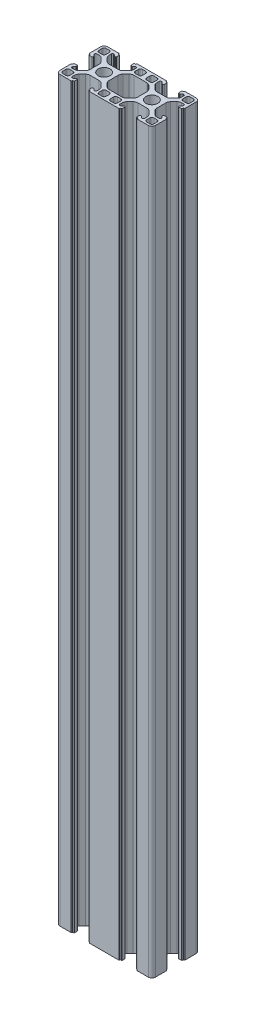
from build123d import *

# Parameters (mm, degrees)
EXTRUDE_1_DEPTH = 309


with BuildPart() as part:
    # Эскиз1 → Бобышка-Вытянуть1 (new body)
    with BuildSketch(Plane(origin=(0, 0, 0), x_dir=(1, 0, 0), z_dir=(0, 1, 0))):
        with BuildLine():
            Line((9.247825015, 4.683728486), (11.146605684, 4.683728486))
            ThreePointArc((11.146605684, 4.683728486), (11.911972549, 4.835969421), (12.560819246, 5.269514923))
            Line((12.560819246, 5.269514923), (13.862038577, 6.570734254))
            ThreePointArc((13.862038577, 6.570734254), (14.29558408, 7.219580952), (14.447825015, 7.984947817))
            Line((14.447825015, 7.984947817), (14.447825015, 8.883728486))
            ThreePointArc((14.447825015, 8.883728486), (14.301378405, 9.237281876), (13.947825015, 9.383728486))
            Line((13.947825015, 9.383728486), (13.844931796, 9.383728486))
            ThreePointArc((13.844931796, 9.383728486), (13.65359008, 9.345668252), (13.491378405, 9.237281876))
            Line((13.491378405, 9.237281876), (13.01104832, 8.75695179))
            ThreePointArc((13.01104832, 8.75695179), (12.929942482, 8.702758603), (12.834271624, 8.683728486))
            Line((12.834271624, 8.683728486), (12.547825015, 8.683728486))
            ThreePointArc((12.547825015, 8.683728486), (12.37104832, 8.75695179), (12.297825015, 8.933728486))
            Line((12.297825015, 8.933728486), (12.297825015, 10.082799306))
            ThreePointArc((12.297825015, 10.082799306), (12.341758998, 10.188865323), (12.447825015, 10.232799306))
            Line((12.447825015, 10.232799306), (12.947825015, 10.232799306))
            Line((12.947825015, 10.232799306), (12.947825015, 10.533728486))
            ThreePointArc((12.947825015, 10.533728486), (12.991758998, 10.639794503), (13.097825015, 10.683728486))
            Line((13.097825015, 10.683728486), (17.747825015, 10.683728486))
            ThreePointArc((17.747825015, 10.683728486), (18.808485187, 10.244388658), (19.247825015, 9.183728486))
            Line((19.247825015, 9.183728486), (19.247825015, 4.533728486))
            ThreePointArc((19.247825015, 4.533728486), (19.203891032, 4.427662469), (19.097825015, 4.383728486))
            Line((19.097825015, 4.383728486), (18.796895835, 4.383728486))
            Line((18.796895835, 4.383728486), (18.796895835, 3.883728486))
            ThreePointArc((18.796895835, 3.883728486), (18.752961853, 3.777662469), (18.646895835, 3.733728486))
            Line((18.646895835, 3.733728486), (17.497825015, 3.733728486))
            ThreePointArc((17.497825015, 3.733728486), (17.32104832, 3.80695179), (17.247825015, 3.983728486))
            Line((17.247825015, 3.983728486), (17.247825015, 4.270175095))
            ThreePointArc((17.247825015, 4.270175095), (17.266855132, 4.365845953), (17.32104832, 4.44695179))
            Line((17.32104832, 4.44695179), (17.801378405, 4.927281876))
            ThreePointArc((17.801378405, 4.927281876), (17.909764781, 5.089493551), (17.947825015, 5.280835267))
            Line((17.947825015, 5.280835267), (17.947825015, 5.383728486))
            ThreePointArc((17.947825015, 5.383728486), (17.801378405, 5.737281876), (17.447825015, 5.883728486))
            Line((17.447825015, 5.883728486), (16.549044346, 5.883728486))
            ThreePointArc((16.549044346, 5.883728486), (15.783677481, 5.731487551), (15.134830783, 5.297942048))
            Line((15.134830783, 5.297942048), (13.833611452, 3.996722717))
            ThreePointArc((13.833611452, 3.996722717), (13.40006595, 3.34787602), (13.247825015, 2.582509155))
            Line((13.247825015, 2.582509155), (13.247825015, 0.683728486))
            Line((13.247825015, 0.683728486), (13.247825015, -1.215052183))
            ThreePointArc((13.247825015, -1.215052183), (13.40006595, -1.980419048), (13.833611452, -2.629265746))
            Line((13.833611452, -2.629265746), (15.134830783, -3.930485077))
            ThreePointArc((15.134830783, -3.930485077), (15.783677481, -4.364030579), (16.549044346, -4.516271514))
            Line((16.549044346, -4.516271514), (17.447825015, -4.516271514))
            ThreePointArc((17.447825015, -4.516271514), (17.801378405, -4.369824905), (17.947825015, -4.016271514))
            Line((17.947825015, -4.016271514), (17.947825015, -3.913378295))
            ThreePointArc((17.947825015, -3.913378295), (17.909764781, -3.722036579), (17.801378405, -3.559824905))
            Line((17.801378405, -3.559824905), (17.32104832, -3.079494819))
            ThreePointArc((17.32104832, -3.079494819), (17.266855132, -2.998388982), (17.247825015, -2.902718124))
            Line((17.247825015, -2.902718124), (17.247825015, -2.616271514))
            ThreePointArc((17.247825015, -2.616271514), (17.32104832, -2.439494819), (17.497825015, -2.366271514))
            Line((17.497825015, -2.366271514), (18.646895835, -2.366271514))
            ThreePointArc((18.646895835, -2.366271514), (18.752961853, -2.410205497), (18.796895835, -2.516271514))
            Line((18.796895835, -2.516271514), (18.796895835, -3.016271514))
            Line((18.796895835, -3.016271514), (19.097825015, -3.016271514))
            ThreePointArc((19.097825015, -3.016271514), (19.203891032, -3.060205497), (19.247825015, -3.166271514))
            Line((19.247825015, -3.166271514), (19.247825015, -7.816271514))
            ThreePointArc((19.247825015, -7.816271514), (18.808485187, -8.876931686), (17.747825015, -9.316271514))
            Line((17.747825015, -9.316271514), (13.097825015, -9.316271514))
            ThreePointArc((13.097825015, -9.316271514), (12.991758998, -9.272337531), (12.947825015, -9.166271514))
            Line((12.947825015, -9.166271514), (12.947825015, -8.865342335))
            Line((12.947825015, -8.865342335), (12.447825015, -8.865342335))
            ThreePointArc((12.447825015, -8.865342335), (12.341758998, -8.821408352), (12.297825015, -8.715342335))
            Line((12.297825015, -8.715342335), (12.297825015, -7.566271514))
            ThreePointArc((12.297825015, -7.566271514), (12.37104832, -7.389494819), (12.547825015, -7.316271514))
            Line((12.547825015, -7.316271514), (12.834271624, -7.316271514))
            ThreePointArc((12.834271624, -7.316271514), (12.929942482, -7.335301631), (13.01104832, -7.389494819))
            Line((13.01104832, -7.389494819), (13.491378405, -7.869824905))
            ThreePointArc((13.491378405, -7.869824905), (13.65359008, -7.978211281), (13.844931796, -8.016271514))
            Line((13.844931796, -8.016271514), (13.947825015, -8.016271514))
            ThreePointArc((13.947825015, -8.016271514), (14.301378405, -7.869824905), (14.447825015, -7.516271514))
            Line((14.447825015, -7.516271514), (14.447825015, -6.617490845))
            ThreePointArc((14.447825015, -6.617490845), (14.29558408, -5.85212398), (13.862038577, -5.203277283))
            Line((13.862038577, -5.203277283), (12.560819246, -3.902057952))
            ThreePointArc((12.560819246, -3.902057952), (11.911972549, -3.468512449), (11.146605684, -3.316271514))
            Line((11.146605684, -3.316271514), (9.247825015, -3.316271514))
            Line((9.247825015, -3.316271514), (7.349044346, -3.316271514))
            ThreePointArc((7.349044346, -3.316271514), (6.583677481, -3.468512449), (5.934830783, -3.902057952))
            Line((5.934830783, -3.902057952), (4.633611452, -5.203277283))
            ThreePointArc((4.633611452, -5.203277283), (4.20006595, -5.85212398), (4.047825015, -6.617490845))
            Line((4.047825015, -6.617490845), (4.047825015, -7.516271514))
            ThreePointArc((4.047825015, -7.516271514), (4.194271624, -7.869824905), (4.547825015, -8.016271514))
            Line((4.547825015, -8.016271514), (4.650718234, -8.016271514))
            ThreePointArc((4.650718234, -8.016271514), (4.84205995, -7.978211281), (5.004271624, -7.869824905))
            Line((5.004271624, -7.869824905), (5.48460171, -7.389494819))
            ThreePointArc((5.48460171, -7.389494819), (5.565707547, -7.335301631), (5.661378405, -7.316271514))
            Line((5.661378405, -7.316271514), (5.947825015, -7.316271514))
            ThreePointArc((5.947825015, -7.316271514), (6.12460171, -7.389494819), (6.197825015, -7.566271514))
            Line((6.197825015, -7.566271514), (6.197825015, -8.715342335))
            ThreePointArc((6.197825015, -8.715342335), (6.153891032, -8.821408352), (6.047825015, -8.865342335))
            Line((6.047825015, -8.865342335), (5.547825015, -8.865342335))
            Line((5.547825015, -8.865342335), (5.547825015, -9.166271514))
            ThreePointArc((5.547825015, -9.166271514), (5.503891032, -9.272337531), (5.397825015, -9.316271514))
            Line((5.397825015, -9.316271514), (0.747825015, -9.316271514))
            Line((0.747825015, -9.316271514), (-2.252174985, -9.316271514))
            Line((-2.252174985, -9.316271514), (-6.902174985, -9.316271514))
            ThreePointArc((-6.902174985, -9.316271514), (-7.008241002, -9.272337531), (-7.052174985, -9.166271514))
            Line((-7.052174985, -9.166271514), (-7.052174985, -8.865342335))
            Line((-7.052174985, -8.865342335), (-7.552174985, -8.865342335))
            ThreePointArc((-7.552174985, -8.865342335), (-7.658241002, -8.821408352), (-7.702174985, -8.715342335))
            Line((-7.702174985, -8.715342335), (-7.702174985, -7.566271514))
            ThreePointArc((-7.702174985, -7.566271514), (-7.62895168, -7.389494819), (-7.452174985, -7.316271514))
            Line((-7.452174985, -7.316271514), (-7.165728376, -7.316271514))
            ThreePointArc((-7.165728376, -7.316271514), (-7.070057518, -7.335301631), (-6.98895168, -7.389494819))
            Line((-6.98895168, -7.389494819), (-6.508621595, -7.869824905))
            ThreePointArc((-6.508621595, -7.869824905), (-6.34640992, -7.978211281), (-6.155068204, -8.016271514))
            Line((-6.155068204, -8.016271514), (-6.052174985, -8.016271514))
            ThreePointArc((-6.052174985, -8.016271514), (-5.698621595, -7.869824905), (-5.552174985, -7.516271514))
            Line((-5.552174985, -7.516271514), (-5.552174985, -6.617490845))
            ThreePointArc((-5.552174985, -6.617490845), (-5.70441592, -5.85212398), (-6.137961423, -5.203277283))
            Line((-6.137961423, -5.203277283), (-7.439180754, -3.902057952))
            ThreePointArc((-7.439180754, -3.902057952), (-8.088027451, -3.468512449), (-8.853394316, -3.316271514))
            Line((-8.853394316, -3.316271514), (-10.752174985, -3.316271514))
            Line((-10.752174985, -3.316271514), (-12.650955654, -3.316271514))
            ThreePointArc((-12.650955654, -3.316271514), (-13.416322519, -3.468512449), (-14.065169217, -3.902057952))
            Line((-14.065169217, -3.902057952), (-15.366388548, -5.203277283))
            ThreePointArc((-15.366388548, -5.203277283), (-15.79993405, -5.85212398), (-15.952174985, -6.617490845))
            Line((-15.952174985, -6.617490845), (-15.952174985, -7.516271514))
            ThreePointArc((-15.952174985, -7.516271514), (-15.805728376, -7.869824905), (-15.452174985, -8.016271514))
            Line((-15.452174985, -8.016271514), (-15.349281766, -8.016271514))
            ThreePointArc((-15.349281766, -8.016271514), (-15.15794005, -7.978211281), (-14.995728376, -7.869824905))
            Line((-14.995728376, -7.869824905), (-14.51539829, -7.389494819))
            ThreePointArc((-14.51539829, -7.389494819), (-14.434292453, -7.335301631), (-14.338621595, -7.316271514))
            Line((-14.338621595, -7.316271514), (-14.052174985, -7.316271514))
            ThreePointArc((-14.052174985, -7.316271514), (-13.87539829, -7.389494819), (-13.802174985, -7.566271514))
            Line((-13.802174985, -7.566271514), (-13.802174985, -8.715342335))
            ThreePointArc((-13.802174985, -8.715342335), (-13.846108968, -8.821408352), (-13.952174985, -8.865342335))
            Line((-13.952174985, -8.865342335), (-14.452174985, -8.865342335))
            Line((-14.452174985, -8.865342335), (-14.452174985, -9.166271514))
            ThreePointArc((-14.452174985, -9.166271514), (-14.496108968, -9.272337531), (-14.602174985, -9.316271514))
            Line((-14.602174985, -9.316271514), (-19.252174985, -9.316271514))
            ThreePointArc((-19.252174985, -9.316271514), (-20.312835157, -8.876931686), (-20.752174985, -7.816271514))
            Line((-20.752174985, -7.816271514), (-20.752174985, -3.166271514))
            ThreePointArc((-20.752174985, -3.166271514), (-20.708241002, -3.060205497), (-20.602174985, -3.016271514))
            Line((-20.602174985, -3.016271514), (-20.301245806, -3.016271514))
            Line((-20.301245806, -3.016271514), (-20.301245806, -2.516271514))
            ThreePointArc((-20.301245806, -2.516271514), (-20.257311823, -2.410205497), (-20.151245806, -2.366271514))
            Line((-20.151245806, -2.366271514), (-19.002174985, -2.366271514))
            ThreePointArc((-19.002174985, -2.366271514), (-18.82539829, -2.439494819), (-18.752174985, -2.616271514))
            Line((-18.752174985, -2.616271514), (-18.752174985, -2.902718124))
            ThreePointArc((-18.752174985, -2.902718124), (-18.771205102, -2.998388982), (-18.82539829, -3.079494819))
            Line((-18.82539829, -3.079494819), (-19.305728376, -3.559824905))
            ThreePointArc((-19.305728376, -3.559824905), (-19.414114751, -3.722036579), (-19.452174985, -3.913378295))
            Line((-19.452174985, -3.913378295), (-19.452174985, -4.016271514))
            ThreePointArc((-19.452174985, -4.016271514), (-19.305728376, -4.369824905), (-18.952174985, -4.516271514))
            Line((-18.952174985, -4.516271514), (-18.053394316, -4.516271514))
            ThreePointArc((-18.053394316, -4.516271514), (-17.288027451, -4.364030579), (-16.639180754, -3.930485077))
            Line((-16.639180754, -3.930485077), (-15.337961423, -2.629265746))
            ThreePointArc((-15.337961423, -2.629265746), (-14.90441592, -1.980419048), (-14.752174985, -1.215052183))
            Line((-14.752174985, -1.215052183), (-14.752174985, 0.683728486))
            Line((-14.752174985, 0.683728486), (-14.752174985, 2.582509155))
            ThreePointArc((-14.752174985, 2.582509155), (-14.90441592, 3.34787602), (-15.337961423, 3.996722717))
            Line((-15.337961423, 3.996722717), (-16.639180754, 5.297942048))
            ThreePointArc((-16.639180754, 5.297942048), (-17.288027451, 5.731487551), (-18.053394316, 5.883728486))
            Line((-18.053394316, 5.883728486), (-18.952174985, 5.883728486))
            ThreePointArc((-18.952174985, 5.883728486), (-19.305728376, 5.737281876), (-19.452174985, 5.383728486))
            Line((-19.452174985, 5.383728486), (-19.452174985, 5.280835267))
            ThreePointArc((-19.452174985, 5.280835267), (-19.414114751, 5.089493551), (-19.305728376, 4.927281876))
            Line((-19.305728376, 4.927281876), (-18.82539829, 4.44695179))
            ThreePointArc((-18.82539829, 4.44695179), (-18.771205102, 4.365845953), (-18.752174985, 4.270175095))
            Line((-18.752174985, 4.270175095), (-18.752174985, 3.983728486))
            ThreePointArc((-18.752174985, 3.983728486), (-18.82539829, 3.80695179), (-19.002174985, 3.733728486))
            Line((-19.002174985, 3.733728486), (-20.151245806, 3.733728486))
            ThreePointArc((-20.151245806, 3.733728486), (-20.257311823, 3.777662469), (-20.301245806, 3.883728486))
            Line((-20.301245806, 3.883728486), (-20.301245806, 4.383728486))
            Line((-20.301245806, 4.383728486), (-20.602174985, 4.383728486))
            ThreePointArc((-20.602174985, 4.383728486), (-20.708241002, 4.427662469), (-20.752174985, 4.533728486))
            Line((-20.752174985, 4.533728486), (-20.752174985, 9.183728486))
            ThreePointArc((-20.752174985, 9.183728486), (-20.312835157, 10.244388658), (-19.252174985, 10.683728486))
            Line((-19.252174985, 10.683728486), (-14.602174985, 10.683728486))
            ThreePointArc((-14.602174985, 10.683728486), (-14.496108968, 10.639794503), (-14.452174985, 10.533728486))
            Line((-14.452174985, 10.533728486), (-14.452174985, 10.232799306))
            Line((-14.452174985, 10.232799306), (-13.952174985, 10.232799306))
            ThreePointArc((-13.952174985, 10.232799306), (-13.846108968, 10.188865323), (-13.802174985, 10.082799306))
            Line((-13.802174985, 10.082799306), (-13.802174985, 8.933728486))
            ThreePointArc((-13.802174985, 8.933728486), (-13.87539829, 8.75695179), (-14.052174985, 8.683728486))
            Line((-14.052174985, 8.683728486), (-14.338621595, 8.683728486))
            ThreePointArc((-14.338621595, 8.683728486), (-14.434292453, 8.702758603), (-14.51539829, 8.75695179))
            Line((-14.51539829, 8.75695179), (-14.995728376, 9.237281876))
            ThreePointArc((-14.995728376, 9.237281876), (-15.15794005, 9.345668252), (-15.349281766, 9.383728486))
            Line((-15.349281766, 9.383728486), (-15.452174985, 9.383728486))
            ThreePointArc((-15.452174985, 9.383728486), (-15.805728376, 9.237281876), (-15.952174985, 8.883728486))
            Line((-15.952174985, 8.883728486), (-15.952174985, 7.984947817))
            ThreePointArc((-15.952174985, 7.984947817), (-15.79993405, 7.219580952), (-15.366388548, 6.570734254))
            Line((-15.366388548, 6.570734254), (-14.065169217, 5.269514923))
            ThreePointArc((-14.065169217, 5.269514923), (-13.416322519, 4.835969421), (-12.650955654, 4.683728486))
            Line((-12.650955654, 4.683728486), (-10.752174985, 4.683728486))
            Line((-10.752174985, 4.683728486), (-8.853394316, 4.683728486))
            ThreePointArc((-8.853394316, 4.683728486), (-8.088027451, 4.835969421), (-7.439180754, 5.269514923))
            Line((-7.439180754, 5.269514923), (-6.137961423, 6.570734254))
            ThreePointArc((-6.137961423, 6.570734254), (-5.70441592, 7.219580952), (-5.552174985, 7.984947817))
            Line((-5.552174985, 7.984947817), (-5.552174985, 8.883728486))
            ThreePointArc((-5.552174985, 8.883728486), (-5.698621595, 9.237281876), (-6.052174985, 9.383728486))
            Line((-6.052174985, 9.383728486), (-6.155068204, 9.383728486))
            ThreePointArc((-6.155068204, 9.383728486), (-6.34640992, 9.345668252), (-6.508621595, 9.237281876))
            Line((-6.508621595, 9.237281876), (-6.98895168, 8.75695179))
            ThreePointArc((-6.98895168, 8.75695179), (-7.070057518, 8.702758603), (-7.165728376, 8.683728486))
            Line((-7.165728376, 8.683728486), (-7.452174985, 8.683728486))
            ThreePointArc((-7.452174985, 8.683728486), (-7.62895168, 8.75695179), (-7.702174985, 8.933728486))
            Line((-7.702174985, 8.933728486), (-7.702174985, 10.082799306))
            ThreePointArc((-7.702174985, 10.082799306), (-7.658241002, 10.188865323), (-7.552174985, 10.232799306))
            Line((-7.552174985, 10.232799306), (-7.052174985, 10.232799306))
            Line((-7.052174985, 10.232799306), (-7.052174985, 10.533728486))
            ThreePointArc((-7.052174985, 10.533728486), (-7.008241002, 10.639794503), (-6.902174985, 10.683728486))
            Line((-6.902174985, 10.683728486), (-2.252174985, 10.683728486))
            Line((-2.252174985, 10.683728486), (0.747825015, 10.683728486))
            Line((0.747825015, 10.683728486), (5.397825015, 10.683728486))
            ThreePointArc((5.397825015, 10.683728486), (5.503891032, 10.639794503), (5.547825015, 10.533728486))
            Line((5.547825015, 10.533728486), (5.547825015, 10.232799306))
            Line((5.547825015, 10.232799306), (6.047825015, 10.232799306))
            ThreePointArc((6.047825015, 10.232799306), (6.153891032, 10.188865323), (6.197825015, 10.082799306))
            Line((6.197825015, 10.082799306), (6.197825015, 8.933728486))
            ThreePointArc((6.197825015, 8.933728486), (6.12460171, 8.75695179), (5.947825015, 8.683728486))
            Line((5.947825015, 8.683728486), (5.661378405, 8.683728486))
            ThreePointArc((5.661378405, 8.683728486), (5.565707547, 8.702758603), (5.48460171, 8.75695179))
            Line((5.48460171, 8.75695179), (5.004271624, 9.237281876))
            ThreePointArc((5.004271624, 9.237281876), (4.84205995, 9.345668252), (4.650718234, 9.383728486))
            Line((4.650718234, 9.383728486), (4.547825015, 9.383728486))
            ThreePointArc((4.547825015, 9.383728486), (4.194271624, 9.237281876), (4.047825015, 8.883728486))
            Line((4.047825015, 8.883728486), (4.047825015, 7.984947817))
            ThreePointArc((4.047825015, 7.984947817), (4.20006595, 7.219580952), (4.633611452, 6.570734254))
            Line((4.633611452, 6.570734254), (5.934830783, 5.269514923))
            ThreePointArc((5.934830783, 5.269514923), (6.583677481, 4.835969421), (7.349044346, 4.683728486))
            Line((7.349044346, 4.683728486), (9.247825015, 4.683728486))
        make_face()
        with BuildLine():
            Line((16.147825015, 6.783728486), (17.547825015, 6.783728486))
            ThreePointArc((17.547825015, 6.783728486), (18.11351044, 7.018043061), (18.347825015, 7.583728486))
            Line((18.347825015, 7.583728486), (18.347825015, 8.983728486))
            ThreePointArc((18.347825015, 8.983728486), (18.11351044, 9.549413911), (17.547825015, 9.783728486))
            Line((17.547825015, 9.783728486), (16.147825015, 9.783728486))
            ThreePointArc((16.147825015, 9.783728486), (15.58213959, 9.549413911), (15.347825015, 8.983728486))
            Line((15.347825015, 8.983728486), (15.347825015, 7.583728486))
            ThreePointArc((15.347825015, 7.583728486), (15.58213959, 7.018043061), (16.147825015, 6.783728486))
        make_face(mode=Mode.SUBTRACT)
        with BuildLine():
            Line((15.347825015, -6.216271514), (15.347825015, -7.616271514))
            ThreePointArc((15.347825015, -7.616271514), (15.58213959, -8.181956939), (16.147825015, -8.416271514))
            Line((16.147825015, -8.416271514), (17.547825015, -8.416271514))
            ThreePointArc((17.547825015, -8.416271514), (18.11351044, -8.181956939), (18.347825015, -7.616271514))
            Line((18.347825015, -7.616271514), (18.347825015, -6.216271514))
            ThreePointArc((18.347825015, -6.216271514), (18.11351044, -5.650586089), (17.547825015, -5.416271514))
            Line((17.547825015, -5.416271514), (16.147825015, -5.416271514))
            ThreePointArc((16.147825015, -5.416271514), (15.58213959, -5.650586089), (15.347825015, -6.216271514))
        make_face(mode=Mode.SUBTRACT)
        with BuildLine():
            Line((2.347825015, -5.416271514), (0.947825015, -5.416271514))
            ThreePointArc((0.947825015, -5.416271514), (0.38213959, -5.650586089), (0.147825015, -6.216271514))
            Line((0.147825015, -6.216271514), (0.147825015, -7.616271514))
            ThreePointArc((0.147825015, -7.616271514), (0.38213959, -8.181956939), (0.947825015, -8.416271514))
            Line((0.947825015, -8.416271514), (2.347825015, -8.416271514))
            ThreePointArc((2.347825015, -8.416271514), (2.91351044, -8.181956939), (3.147825015, -7.616271514))
            Line((3.147825015, -7.616271514), (3.147825015, -6.216271514))
            ThreePointArc((3.147825015, -6.216271514), (2.91351044, -5.650586089), (2.347825015, -5.416271514))
        make_face(mode=Mode.SUBTRACT)
        with BuildLine():
            Line((1.047825015, -4.516271514), (1.946605684, -4.516271514))
            ThreePointArc((1.946605684, -4.516271514), (2.711972549, -4.364030579), (3.360819246, -3.930485077))
            Line((3.360819246, -3.930485077), (4.662038577, -2.629265746))
            ThreePointArc((4.662038577, -2.629265746), (5.09558408, -1.980419048), (5.247825015, -1.215052183))
            Line((5.247825015, -1.215052183), (5.247825015, 0.683728486))
            Line((5.247825015, 0.683728486), (5.247825015, 2.582509155))
            ThreePointArc((5.247825015, 2.582509155), (5.09558408, 3.34787602), (4.662038577, 3.996722717))
            Line((4.662038577, 3.996722717), (3.360819246, 5.297942048))
            ThreePointArc((3.360819246, 5.297942048), (2.711972549, 5.731487551), (1.946605684, 5.883728486))
            Line((1.946605684, 5.883728486), (1.047825015, 5.883728486))
            Line((1.047825015, 5.883728486), (-2.552174985, 5.883728486))
            Line((-2.552174985, 5.883728486), (-3.450955654, 5.883728486))
            ThreePointArc((-3.450955654, 5.883728486), (-4.216322519, 5.731487551), (-4.865169217, 5.297942048))
            Line((-4.865169217, 5.297942048), (-6.166388548, 3.996722717))
            ThreePointArc((-6.166388548, 3.996722717), (-6.59993405, 3.34787602), (-6.752174985, 2.582509155))
            Line((-6.752174985, 2.582509155), (-6.752174985, 0.683728486))
            Line((-6.752174985, 0.683728486), (-6.752174985, -1.215052183))
            ThreePointArc((-6.752174985, -1.215052183), (-6.59993405, -1.980419048), (-6.166388548, -2.629265746))
            Line((-6.166388548, -2.629265746), (-4.865169217, -3.930485077))
            ThreePointArc((-4.865169217, -3.930485077), (-4.216322519, -4.364030579), (-3.450955654, -4.516271514))
            Line((-3.450955654, -4.516271514), (-2.552174985, -4.516271514))
            Line((-2.552174985, -4.516271514), (1.047825015, -4.516271514))
        make_face(mode=Mode.SUBTRACT)
        with BuildLine():
            Line((3.147825015, 7.583728486), (3.147825015, 8.983728486))
            ThreePointArc((3.147825015, 8.983728486), (2.91351044, 9.549413911), (2.347825015, 9.783728486))
            Line((2.347825015, 9.783728486), (0.947825015, 9.783728486))
            ThreePointArc((0.947825015, 9.783728486), (0.38213959, 9.549413911), (0.147825015, 8.983728486))
            Line((0.147825015, 8.983728486), (0.147825015, 7.583728486))
            ThreePointArc((0.147825015, 7.583728486), (0.38213959, 7.018043061), (0.947825015, 6.783728486))
            Line((0.947825015, 6.783728486), (2.347825015, 6.783728486))
            ThreePointArc((2.347825015, 6.783728486), (2.91351044, 7.018043061), (3.147825015, 7.583728486))
        make_face(mode=Mode.SUBTRACT)
        with BuildLine():
            Line((-2.452174985, 9.783728486), (-3.852174985, 9.783728486))
            ThreePointArc((-3.852174985, 9.783728486), (-4.41786041, 9.549413911), (-4.652174985, 8.983728486))
            Line((-4.652174985, 8.983728486), (-4.652174985, 7.583728486))
            ThreePointArc((-4.652174985, 7.583728486), (-4.41786041, 7.018043061), (-3.852174985, 6.783728486))
            Line((-3.852174985, 6.783728486), (-2.452174985, 6.783728486))
            ThreePointArc((-2.452174985, 6.783728486), (-1.88648956, 7.018043061), (-1.652174985, 7.583728486))
            Line((-1.652174985, 7.583728486), (-1.652174985, 8.983728486))
            ThreePointArc((-1.652174985, 8.983728486), (-1.88648956, 9.549413911), (-2.452174985, 9.783728486))
        make_face(mode=Mode.SUBTRACT)
        with BuildLine():
            Line((-1.652174985, -7.616271514), (-1.652174985, -6.216271514))
            ThreePointArc((-1.652174985, -6.216271514), (-1.88648956, -5.650586089), (-2.452174985, -5.416271514))
            Line((-2.452174985, -5.416271514), (-3.852174985, -5.416271514))
            ThreePointArc((-3.852174985, -5.416271514), (-4.41786041, -5.650586089), (-4.652174985, -6.216271514))
            Line((-4.652174985, -6.216271514), (-4.652174985, -7.616271514))
            ThreePointArc((-4.652174985, -7.616271514), (-4.41786041, -8.181956939), (-3.852174985, -8.416271514))
            Line((-3.852174985, -8.416271514), (-2.452174985, -8.416271514))
            ThreePointArc((-2.452174985, -8.416271514), (-1.88648956, -8.181956939), (-1.652174985, -7.616271514))
        make_face(mode=Mode.SUBTRACT)
        with BuildLine():
            Line((-19.052174985, -8.416271514), (-17.652174985, -8.416271514))
            ThreePointArc((-17.652174985, -8.416271514), (-17.08648956, -8.181956939), (-16.852174985, -7.616271514))
            Line((-16.852174985, -7.616271514), (-16.852174985, -6.216271514))
            ThreePointArc((-16.852174985, -6.216271514), (-17.08648956, -5.650586089), (-17.652174985, -5.416271514))
            Line((-17.652174985, -5.416271514), (-19.052174985, -5.416271514))
            ThreePointArc((-19.052174985, -5.416271514), (-19.61786041, -5.650586089), (-19.852174985, -6.216271514))
            Line((-19.852174985, -6.216271514), (-19.852174985, -7.616271514))
            ThreePointArc((-19.852174985, -7.616271514), (-19.61786041, -8.181956939), (-19.052174985, -8.416271514))
        make_face(mode=Mode.SUBTRACT)
        with BuildLine():
            Line((-19.852174985, 8.983728486), (-19.852174985, 7.583728486))
            ThreePointArc((-19.852174985, 7.583728486), (-19.61786041, 7.018043061), (-19.052174985, 6.783728486))
            Line((-19.052174985, 6.783728486), (-17.652174985, 6.783728486))
            ThreePointArc((-17.652174985, 6.783728486), (-17.08648956, 7.018043061), (-16.852174985, 7.583728486))
            Line((-16.852174985, 7.583728486), (-16.852174985, 8.983728486))
            ThreePointArc((-16.852174985, 8.983728486), (-17.08648956, 9.549413911), (-17.652174985, 9.783728486))
            Line((-17.652174985, 9.783728486), (-19.052174985, 9.783728486))
            ThreePointArc((-19.052174985, 9.783728486), (-19.61786041, 9.549413911), (-19.852174985, 8.983728486))
        make_face(mode=Mode.SUBTRACT)
        with BuildLine():
            ThreePointArc((11.747825015, 0.683728486), (11.015591968, 2.451495439), (9.247825015, 3.183728486))
            ThreePointArc((9.247825015, 3.183728486), (7.480058062, 2.451495439), (6.747825015, 0.683728486))
            ThreePointArc((6.747825015, 0.683728486), (7.480058062, -1.084038467), (9.247825015, -1.816271514))
            ThreePointArc((9.247825015, -1.816271514), (11.015591968, -1.084038467), (11.747825015, 0.683728486))
        make_face(mode=Mode.SUBTRACT)
        with BuildLine():
            ThreePointArc((-10.752174985, 3.183728486), (-8.984408032, 2.451495439), (-8.252174985, 0.683728486))
            ThreePointArc((-8.252174985, 0.683728486), (-8.984408032, -1.084038467), (-10.752174985, -1.816271514))
            ThreePointArc((-10.752174985, -1.816271514), (-12.519941938, -1.084038467), (-13.252174985, 0.683728486))
            ThreePointArc((-13.252174985, 0.683728486), (-12.519941938, 2.451495439), (-10.752174985, 3.183728486))
        make_face(mode=Mode.SUBTRACT)
    extrude(amount=EXTRUDE_1_DEPTH)


solid = part.part
